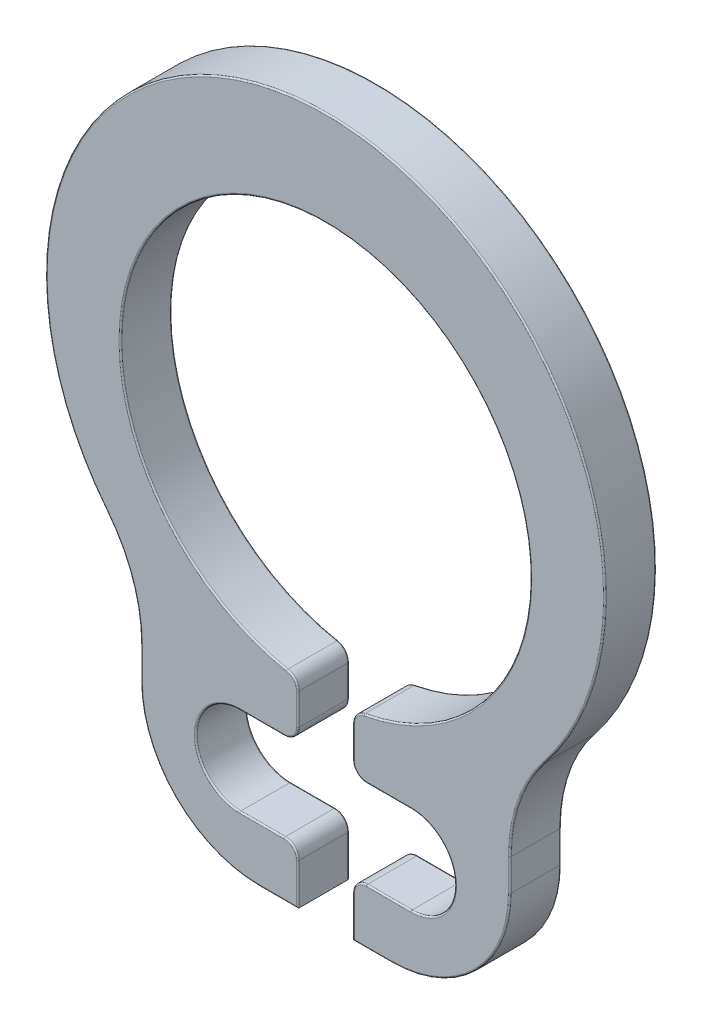
from build123d import *

# Parameters (mm, degrees)
SKETCH3_R                    = 2.8
BOSS_EXTRUDE1_DEPTH          = 0.35
CUT_EXTRUDE_THIN1_DEPTH      = 7.144501607
CUT_EXTRUDE_THIN1_DEPTH_BACK = 7.144501607
SKETCH4_W                    = 0.75
SKETCH4_H                    = 5.5
FILLET2_R                    = 0.1875
FILLET1_R                    = 0.02


with BuildPart() as part:
    # Sketch3 → Boss-Extrude1 (new, symmetric)
    with BuildSketch(Plane.XY):
        with BuildLine():
            Line((2.52, -2.746214287), (2.52, -3.18))
            ThreePointArc((2.52, -3.18), (2.045512986, -4.325512986), (0.9, -4.8))
            Line((0.9, -4.8), (-0.9, -4.8))
            ThreePointArc((-0.9, -4.8), (-2.045512986, -4.325512986), (-2.52, -3.18))
            Line((-2.52, -3.18), (-2.52, -2.746214287))
            ThreePointArc((-2.52, -2.746214287), (-2.641127038, -2.031314096), (-2.990987406, -1.396214287))
            ThreePointArc((-2.990987406, -1.396214287), (0, 4.8), (2.990987406, -1.396214287))
            ThreePointArc((2.990987406, -1.396214287), (2.641127038, -2.031314096), (2.52, -2.746214287))
        make_face()
        with Locations((0, 0.7)):
            Circle(SKETCH3_R, mode=Mode.SUBTRACT)
        with BuildLine():
            Line((-1.17, -4.05), (1.17, -4.05))
            ThreePointArc((1.17, -4.05), (1.77, -3.45), (1.17, -2.85))
            Line((1.17, -2.85), (-1.17, -2.85))
            ThreePointArc((-1.17, -2.85), (-1.77, -3.45), (-1.17, -4.05))
        make_face(mode=Mode.SUBTRACT)
    extrude(amount=BOSS_EXTRUDE1_DEPTH, both=True)

    # Sketch4 → Cut-Extrude-Thin1 (cut, two sides: drawn at the far end of the back side and taken through both)
    with BuildSketch(Plane.XY.offset(-CUT_EXTRUDE_THIN1_DEPTH_BACK)):
        with Locations((0, -2.05)):
            Rectangle(SKETCH4_W, SKETCH4_H)
    extrude(amount=CUT_EXTRUDE_THIN1_DEPTH + CUT_EXTRUDE_THIN1_DEPTH_BACK, mode=Mode.SUBTRACT)

    # Fillet2
    fillet2_edges = [part.edges().sort_by_distance(p)[0] for p in [
        (0.375, -2.074774766, 0),
        (-0.375, -2.074774766, 0),
        (-0.375, -4.05, 0),
        (-0.375, -2.85, 0),
        (0.375, -4.05, 0),
        (0.375, -2.85, 0),
    ]]
    fillet(fillet2_edges, radius=FILLET2_R)

    # Fillet1
    fillet1_edges = [part.edges().sort_by_distance(p)[0] for p in [
        (-2.045512986, -4.325512986, 0.35),
        (-2.52, -2.963107144, -0.35),
        (-2.641127038, -2.031314096, -0.35),
        (-0.6375, -4.8, 0.35),
        (2.045512986, -4.325512986, 0.35),
        (2.52, -2.963107144, 0.35),
        (2.641127038, -2.031314096, 0.35),
        (-1.77, -3.45, -0.35),
        (-0.86625, -4.05, -0.35),
        (1.77, -3.45, -0.35),
        (0.86625, -2.85, -0.35),
        (0, 4.8, 0.35),
        (-1.77, -3.45, 0.35),
        (-0.86625, -4.05, 0.35),
        (1.77, -3.45, 0.35),
        (0.86625, -2.85, 0.35),
        (-2.641127038, -2.031314096, 0.35),
        (0.6375, -4.8, -0.35),
        (0.6375, -4.8, 0.35),
        (-2.52, -2.963107144, 0.35),
        (0, 4.8, -0.35),
        (0.86625, -4.05, -0.35),
        (0.86625, -4.05, 0.35),
        (-0.375, -4.51875, 0.35),
        (-0.86625, -2.85, 0.35),
        (-0.375, -2.448283572, 0.35),
        (0, 3.5, 0.35),
        (0.375, -2.448283572, 0.35),
        (2.641127038, -2.031314096, -0.35),
        (0.375, -4.51875, 0.35),
        (-0.41797383, -2.114616583, 0.35),
        (-0.429917479, -2.795082521, 0.35),
        (0.41797383, -2.114616583, 0.35),
        (0.429917479, -2.795082521, 0.35),
        (-0.429917479, -4.104917479, 0.35),
        (0.429917479, -4.104917479, 0.35),
        (0.375, -4.51875, -0.35),
        (2.52, -2.963107144, -0.35),
        (-0.375, -4.51875, -0.35),
        (0.375, -2.448283572, -0.35),
        (0, 3.5, -0.35),
        (-0.375, -2.448283572, -0.35),
        (-0.86625, -2.85, -0.35),
        (-0.41797383, -2.114616583, -0.35),
        (-0.429917479, -2.795082521, -0.35),
        (2.045512986, -4.325512986, -0.35),
        (0.41797383, -2.114616583, -0.35),
        (0.429917479, -2.795082521, -0.35),
        (-0.429917479, -4.104917479, -0.35),
        (0.429917479, -4.104917479, -0.35),
        (-0.6375, -4.8, -0.35),
        (-2.045512986, -4.325512986, -0.35),
    ]]
    fillet(fillet1_edges, radius=FILLET1_R)


solid = part.part
